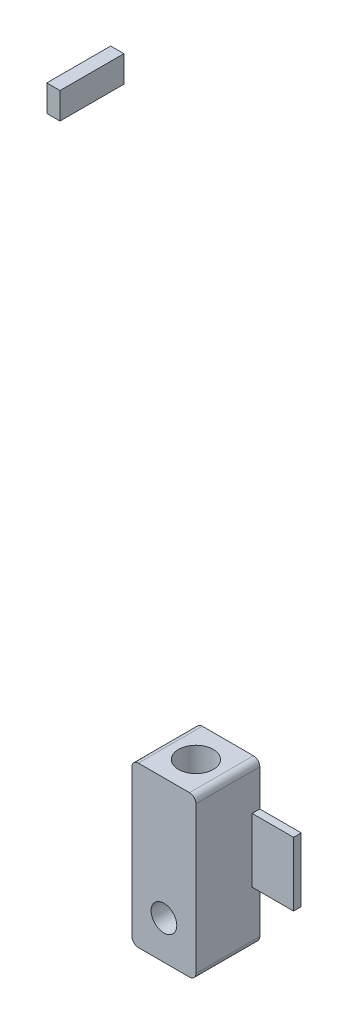
from build123d import *

# Parameters (mm, degrees)
SKETCH1_W                    = 12.7
SKETCH1_H                    = 31.75
BOSS_EXTRUDE1_DEPTH          = 6.35
F_5_16_24_TAPPED_HOLE1_D     = 6.9088
F_5_16_24_TAPPED_HOLE1_DEPTH = 12.7
F_5_16_24_TAPPED_HOLE1_TIP   = 2.075612922
CUT_EXTRUDE1_DEPTH           = 22.298547486
CUT_EXTRUDE1_DEPTH_BACK      = 22.298547486
SKETCH8_R                    = 2.5527
SKETCH13_W                   = 2.629886975
SKETCH13_H                   = 5.259773951
BOSS_EXTRUDE2_DEPTH          = 12.7
SKETCH14_W                   = 6.790912291
SKETCH14_H                   = 12.7
SKETCH14_W_2                 = 8.232513551
BOSS_EXTRUDE3_DEPTH          = 1.524
FILLET1_R                    = 1.27


with BuildPart() as part:
    # Sketch1 → Boss-Extrude1 (new, symmetric)
    with BuildSketch(Plane(origin=(0, 0, 0), x_dir=(0, 0, -1), z_dir=(1, 0, 0))):
        Rectangle(SKETCH1_W, SKETCH1_H)
    extrude(amount=BOSS_EXTRUDE1_DEPTH, both=True)

    # 5/16-24 Tapped Hole1
    with Locations(Plane(origin=(0, 15.875, 0), x_dir=(1, 0, 0), z_dir=(0, 1, 0))):
        with Locations((0, 0)):
            Hole(F_5_16_24_TAPPED_HOLE1_D / 2, depth=F_5_16_24_TAPPED_HOLE1_DEPTH)
            with Locations((0, 0, -(F_5_16_24_TAPPED_HOLE1_DEPTH + F_5_16_24_TAPPED_HOLE1_TIP / 2))):  # 118° drill point
                Cone(0, F_5_16_24_TAPPED_HOLE1_D / 2, F_5_16_24_TAPPED_HOLE1_TIP, mode=Mode.SUBTRACT)

    # Sketch8 → Cut-Extrude1 (cut, two sides: drawn at the far end of the back side and taken through both)
    with BuildSketch(Plane.XY.offset(6.35).offset(-CUT_EXTRUDE1_DEPTH_BACK)):
        with Locations((0, -8.255)):
            Circle(SKETCH8_R)
    extrude(amount=CUT_EXTRUDE1_DEPTH + CUT_EXTRUDE1_DEPTH_BACK, mode=Mode.SUBTRACT)

    # Sketch14 → Boss-Extrude3 (add)
    with BuildSketch(Plane(origin=(0, 0, -6.35), x_dir=(-1, 0, 0), z_dir=(0, 0, -1))):
        with Locations((9.745456146, 0.998266939)):
            Rectangle(SKETCH14_W, SKETCH14_H)
        with Locations((-10.466256776, 0.998266939)):
            Rectangle(SKETCH14_W_2, SKETCH14_H)
    extrude(amount=-BOSS_EXTRUDE3_DEPTH)

    # Fillet1
    fillet1_edges = [part.edges().sort_by_distance(p)[0] for p in [
        (6.35, -15.875, 0),
        (-6.35, -15.875, 0),
        (-6.35, 15.875, 0),
        (6.35, 15.875, 0),
    ]]
    fillet(fillet1_edges, radius=FILLET1_R)


with BuildPart() as body_2:
    # Sketch13 → Boss-Extrude2 (new body)
    with BuildSketch(Plane(origin=(0, 0, -6.35), x_dir=(-1, 0, 0), z_dir=(0, 0, -1))):
        with Locations((21.968389845, 121.195113025)):
            Rectangle(SKETCH13_W, SKETCH13_H)
    extrude(amount=-BOSS_EXTRUDE2_DEPTH)


solid = Compound([part.part, body_2.part])
